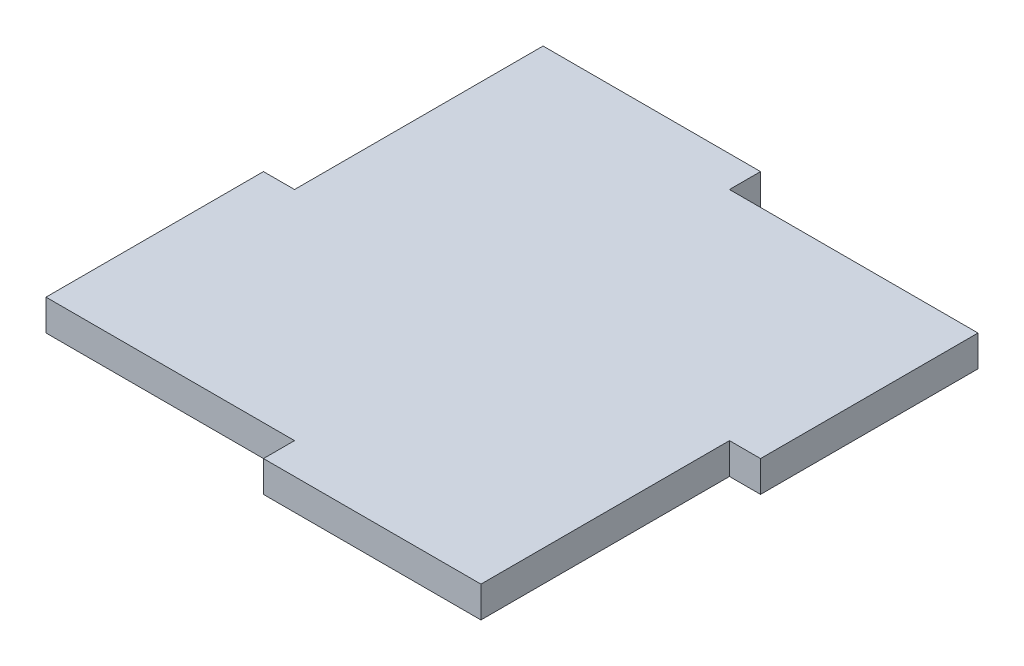
from build123d import *

# Parameters (mm, degrees)
SKETCH1_W           = 12.7
SKETCH1_H           = 88.9
SKETCH1_W_2         = 88.9
SKETCH1_H_2         = 12.7
SKETCH1_W_3         = 177.8
SKETCH1_H_3         = 177.8
BOSS_EXTRUDE1_DEPTH = 12.7


with BuildPart() as part:
    # Sketch1 → Boss-Extrude1 (new body)
    with BuildSketch(Plane(origin=(0, 0, 0), x_dir=(1, 0, 0), z_dir=(0, 1, 0))):
        with Locations((-118.856214689, -40.037288136)):
            Rectangle(SKETCH1_W, SKETCH1_H)
        with Locations((-68.056214689, 99.662711864)):
            Rectangle(SKETCH1_W_2, SKETCH1_H_2)
        with Locations((-23.606214689, 4.412711864)):
            Rectangle(SKETCH1_W_3, SKETCH1_H_3)
        with Locations((71.643785311, 48.862711864)):
            Rectangle(SKETCH1_W, SKETCH1_H)
        with Locations((20.843785311, -90.837288136)):
            Rectangle(SKETCH1_W_2, SKETCH1_H_2)
    extrude(amount=BOSS_EXTRUDE1_DEPTH)


solid = part.part
